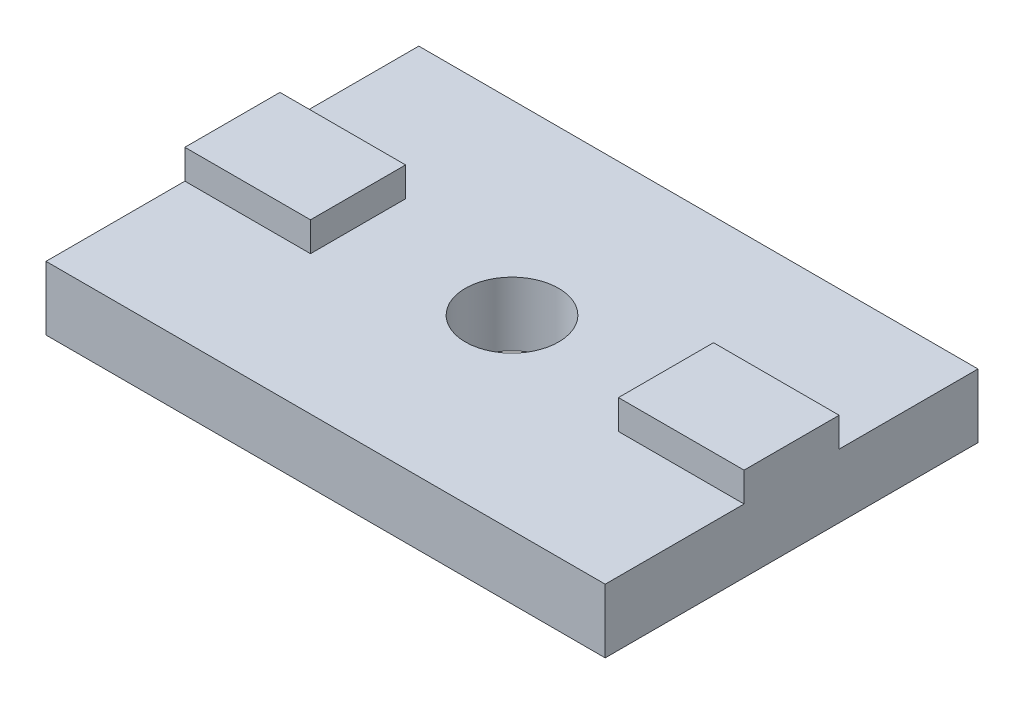
from build123d import *

# Parameters (mm, degrees)
SKETCH1_W           = 38.1
SKETCH1_H           = 25.4
SKETCH1_R           = 3.175
BOSS_EXTRUDE1_DEPTH = 4.35
SKETCH2_W           = 8.5598
SKETCH2_H           = 6.476913764
BOSS_EXTRUDE2_DEPTH = 2


with BuildPart() as part:
    # Sketch1 → Boss-Extrude1 (new body)
    with BuildSketch(Plane(origin=(0, 0, 0), x_dir=(1, 0, 0), z_dir=(0, 1, 0))):
        with Locations((16.172116278, 18.931628639)):
            Rectangle(SKETCH1_W, SKETCH1_H)
        with Locations(Location((16.172116278, 18.931628639, 0), (0, 0, 270))):
            Circle(SKETCH1_R, mode=Mode.SUBTRACT)
    extrude(amount=BOSS_EXTRUDE1_DEPTH)

    # Sketch2 → Boss-Extrude2 (add)
    with BuildSketch(Plane(origin=(0, 4.35, 0), x_dir=(1, 0, 0), z_dir=(0, 1, 0))):
        with Locations((1.402016278, 18.931628639)):
            Rectangle(SKETCH2_W, SKETCH2_H)
        with Locations((30.942216278, 18.931628639)):
            Rectangle(SKETCH2_W, SKETCH2_H)
    extrude(amount=BOSS_EXTRUDE2_DEPTH)


solid = part.part
